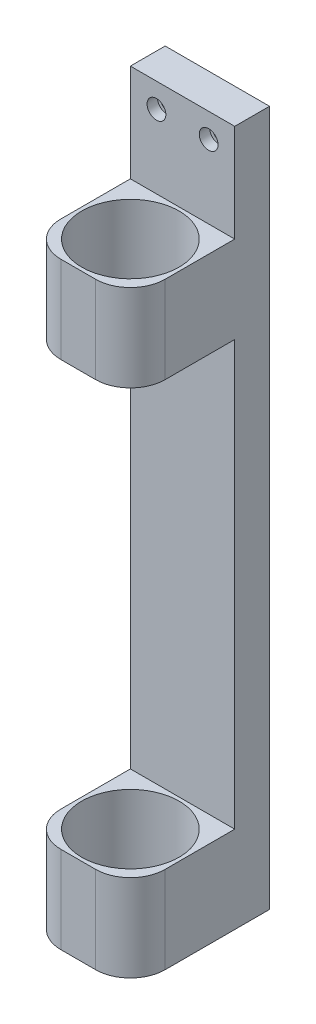
from build123d import *

# Parameters (mm, degrees)
SKETCH1_W                      = 30
SKETCH1_H                      = 10
BOSS_EXTRUDE1_DEPTH            = 200
SKETCH2_W                      = 30
SKETCH2_H                      = 25
BOSS_EXTRUDE2_DEPTH            = 30
SKETCH3_R                      = 14
CUT_EXTRUDE1_DEPTH             = 23
FILLET1_R                      = 10
FILLET2_R                      = 10
SKETCH5_W                      = 30
SKETCH5_H                      = 25
BOSS_EXTRUDE3_DEPTH            = 30
SKETCH6_R                      = 14
CUT_EXTRUDE2_DEPTH             = 30
FILLET3_R                      = 10
FILLET4_R                      = 10
CBORE_FOR_M3_SHCS1_D           = 3.4
CBORE_FOR_M3_SHCS1_CBORE_D     = 5.4
CBORE_FOR_M3_SHCS1_CBORE_DEPTH = 3
SKETCH11_R                     = 10
CUT_EXTRUDE3_DEPTH             = 10


with BuildPart() as part:
    # Sketch1 → Boss-Extrude1 (new body)
    with BuildSketch(Plane(origin=(0, 0, 0), x_dir=(1, 0, 0), z_dir=(0, 1, 0))):
        Rectangle(SKETCH1_W, SKETCH1_H)
    extrude(amount=BOSS_EXTRUDE1_DEPTH)

    # Sketch2 → Boss-Extrude2 (add)
    with BuildSketch(Plane.XY.offset(5)):
        with Locations((0, 12.5)):
            Rectangle(SKETCH2_W, SKETCH2_H)
    extrude(amount=BOSS_EXTRUDE2_DEPTH)

    # Sketch3 → Cut-Extrude1 (cut)
    with BuildSketch(Plane(origin=(0, 25, 0), x_dir=(1, 0, 0), z_dir=(0, 1, 0))):
        with Locations((0, -20)):
            Circle(SKETCH3_R)
    extrude(amount=-CUT_EXTRUDE1_DEPTH, mode=Mode.SUBTRACT)

    # Fillet1
    fillet1_edges = [part.edges().sort_by_distance(p)[0] for p in [
        (15, 12.5, 35),
    ]]
    fillet(fillet1_edges, radius=FILLET1_R)

    # Fillet2
    fillet2_edges = [part.edges().sort_by_distance(p)[0] for p in [
        (-15, 12.5, 35),
    ]]
    fillet(fillet2_edges, radius=FILLET2_R)

    # Sketch5 → Boss-Extrude3 (add)
    with BuildSketch(Plane.XY.offset(5)):
        with Locations((0, 159.428426998)):
            Rectangle(SKETCH5_W, SKETCH5_H)
    extrude(amount=BOSS_EXTRUDE3_DEPTH)

    # Sketch6 → Cut-Extrude2 (cut)
    with BuildSketch(Plane(origin=(0, 171.928426998, 0), x_dir=(1, 0, 0), z_dir=(0, 1, 0))):
        with Locations((0, -20)):
            Circle(SKETCH6_R)
    extrude(amount=-CUT_EXTRUDE2_DEPTH, mode=Mode.SUBTRACT)

    # Fillet3
    fillet3_edges = [part.edges().sort_by_distance(p)[0] for p in [
        (-15, 159.428426998, 35),
    ]]
    fillet(fillet3_edges, radius=FILLET3_R)

    # Fillet4
    fillet4_edges = [part.edges().sort_by_distance(p)[0] for p in [
        (15, 159.428426998, 35),
    ]]
    fillet(fillet4_edges, radius=FILLET4_R)

    # CBORE for M3 SHCS1 (through all)
    with Locations(Plane.XY.offset(5)):
        with Locations((-7.5, 192.982106749)):
            cbore_for_m3_shcs1 = CounterBoreHole(CBORE_FOR_M3_SHCS1_D / 2, CBORE_FOR_M3_SHCS1_CBORE_D / 2, CBORE_FOR_M3_SHCS1_CBORE_DEPTH)

    # Mirror1: CBORE for M3 SHCS1 across plane
    add(cbore_for_m3_shcs1.mirror(Plane(origin=(0, 0, 0), x_dir=(0, 0, 1), z_dir=(1, 0, 0))), mode=Mode.SUBTRACT)

    # Sketch11 → Cut-Extrude3 (cut)
    with BuildSketch(Plane(origin=(0, 2, 0), x_dir=(1, 0, 0), z_dir=(0, 1, 0))):
        with Locations((0, -20)):
            Circle(SKETCH11_R)
    extrude(amount=-CUT_EXTRUDE3_DEPTH, mode=Mode.SUBTRACT)


solid = part.part
